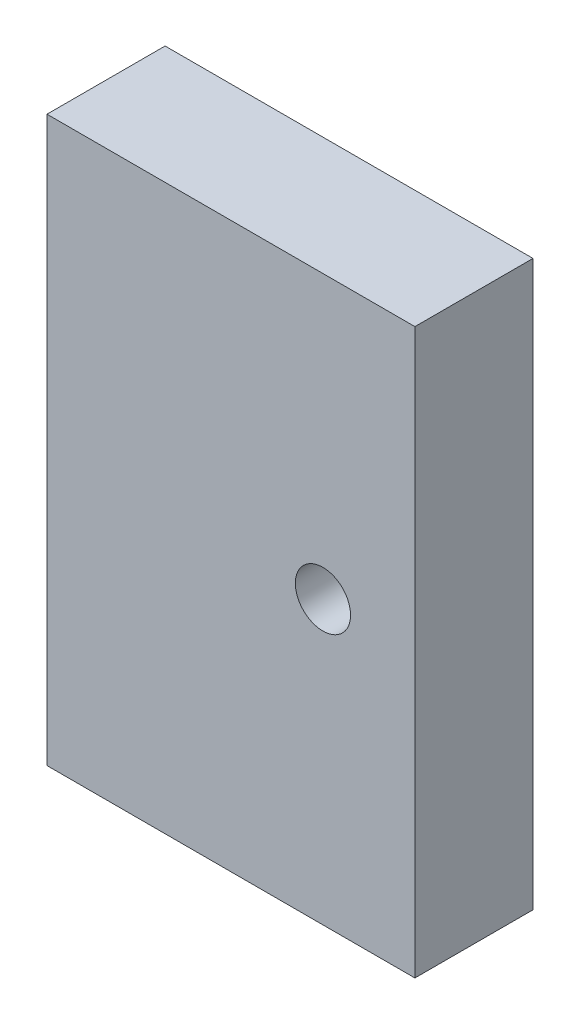
from build123d import *

# Parameters (mm, degrees)
SKETCH1_W          = 30
SKETCH1_H          = 46
EXTRUDE_3_8_DEPTH  = 9.63
SKETCH3_R          = 1.75
M4_DRILL_DEPTH     = 8
SKETCH5_R          = 2.25
CUT_EXTRUDE1_DEPTH = 10


with BuildPart() as part:
    # Sketch1 → 3/8 (new body)
    with BuildSketch(Plane.XY):
        Rectangle(SKETCH1_W, SKETCH1_H)
    extrude(amount=EXTRUDE_3_8_DEPTH)

    # Sketch3 → M4_DRILL (cut)
    with BuildSketch(Plane.XZ.offset(23)):
        with Locations(Location((-1.989909349, 4.787451112, 0), (0, 0, 270))):
            Circle(SKETCH3_R)
        with Locations(Location((10.005417301, 4.787451112, 0), (0, 0, 270))):
            Circle(SKETCH3_R)
    extrude(amount=-M4_DRILL_DEPTH, mode=Mode.SUBTRACT)

    # Sketch5 → Cut-Extrude1 (cut)
    with BuildSketch(Plane.XY.offset(9.63)):
        with Locations((7.5, 0)):
            Circle(SKETCH5_R)
    extrude(amount=-CUT_EXTRUDE1_DEPTH, mode=Mode.SUBTRACT)


solid = part.part
